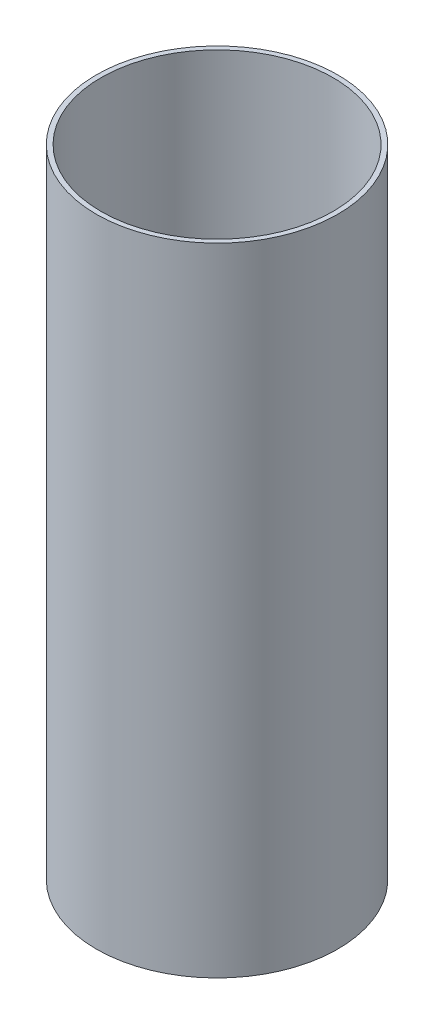
from build123d import *

# Parameters (mm, degrees)
SKETCH1_R           = 37.95
SKETCH1_R_2         = 36.45
BOSS_EXTRUDE1_DEPTH = 200


with BuildPart() as part:
    # Sketch1 → Boss-Extrude1 (new body)
    with BuildSketch(Plane(origin=(0, 0, 0), x_dir=(1, 0, 0), z_dir=(0, 1, 0))):
        with Locations(Location((0, 0, 0), (0, 0, 270))):
            Circle(SKETCH1_R)
        with Locations(Location((0, 0, 0), (0, 0, 270))):
            Circle(SKETCH1_R_2, mode=Mode.SUBTRACT)
    extrude(amount=BOSS_EXTRUDE1_DEPTH)


solid = part.part
